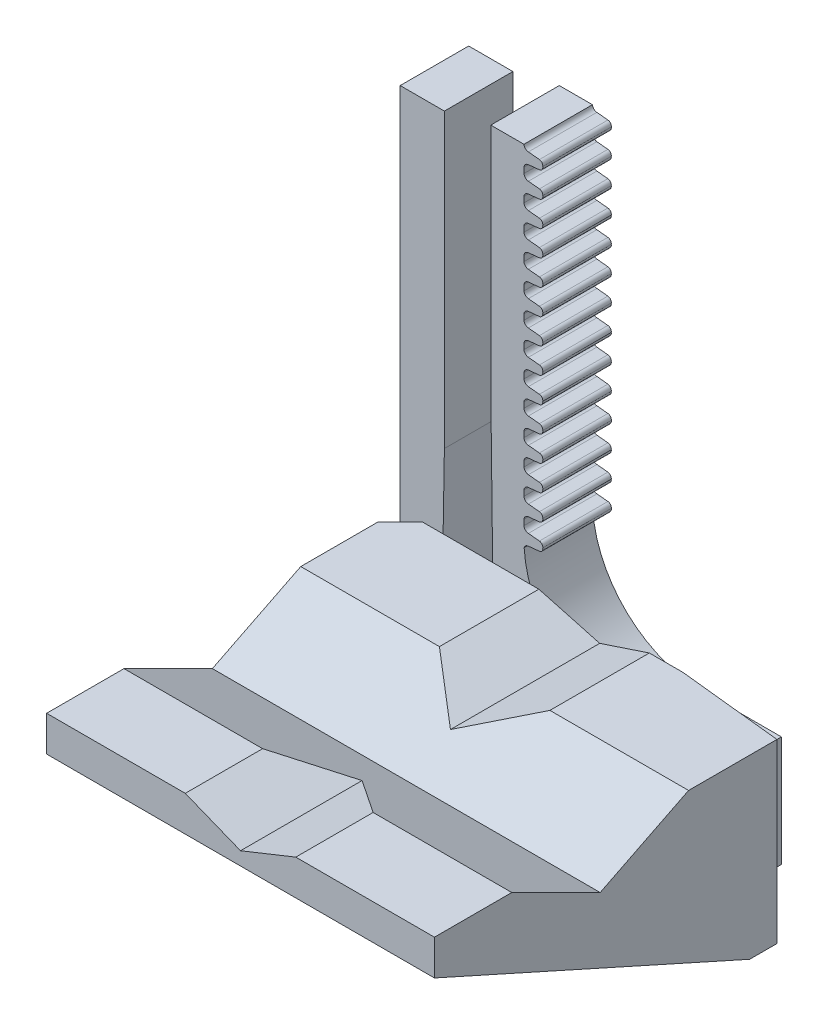
from build123d import *

# Parameters (mm, degrees)
BOSS_EXTRUDE1_DEPTH = 6.2
BOSS_EXTRUDE2_DEPTH = 21
CHAMFER1_SIZE       = 5
CHAMFER1_SIZE2      = 28.356409098
CUT_EXTRUDE1_REACH  = 74.109
CHAMFER2_SIZE       = 1
CHAMFER2_SIZE2      = 9.514364454
CHAMFER3_SIZE       = 2
CUT_EXTRUDE2_REACH  = 79.092
CUT_EXTRUDE3_START  = -3.468867
CUT_EXTRUDE3_DEPTH  = 3.468867
BOSS_EXTRUDE3_DEPTH = 6.2
CUT_EXTRUDE4_REACH  = 79.092
CUT_EXTRUDE5_DEPTH  = 73.108598655
CUT_EXTRUDE6_REACH  = 74.109


with BuildPart() as part:
    # Sketch1 → Boss-Extrude1 (new body)
    with BuildSketch(Plane.XY):
        with BuildLine():
            Line((-28.3, 0), (0, 0))
            Line((0, 0), (0, 10))
            Line((0, 10), (-7.1, 10))
            ThreePointArc((-7.1, 10), (-14.171067812, 12.928932188), (-17.1, 20))
            Line((-17.1, 20), (-17.1, 51))
            Line((-17.1, 51), (-20.1, 51))
            Line((-20.1, 51), (-20.1, 6))
            Line((-20.1, 6), (-24.3, 6))
            Line((-24.3, 6), (-24.3, 50))
            Line((-24.3, 50), (-28.3, 50))
            Line((-28.3, 50), (-28.3, 0))
        make_face()
    extrude(amount=BOSS_EXTRUDE1_DEPTH)

    # Sketch2 → Boss-Extrude2 (add)
    with BuildSketch(Plane.XZ):
        Polygon((0, 6.2), (0, 10.4), (11, 10.4), (11, 42.4), (-24.1, 42.4), (-24.1, 10.4), (-13.1, 10.4), (-13.1, 6.2), align=None)
    extrude(amount=-BOSS_EXTRUDE2_DEPTH)

    # Chamfer1
    chamfer1_edges = [part.edges().sort_by_distance(p)[0] for p in [
        (-6.55, 0, 42.4),
    ]]
    chamfer1_side = [part.faces().sort_by_distance(p)[0] for p in [
        (-6.55, 10.5, 42.4),
    ]]
    chamfer(chamfer1_edges, length=CHAMFER1_SIZE, length2=CHAMFER1_SIZE2, reference=chamfer1_side[0])

    # Sketch3 → Cut-Extrude1 (cut, up to next)
    with BuildSketch(Plane(origin=(0, 0, 0), x_dir=(0, 0, -1), z_dir=(1, 0, 0)), mode=Mode.PRIVATE) as cut_extrude1_sk1:
        Polygon((-6.2, 10), (-7.6, 10), (-10.4, 21), (-6.2, 21), align=None)
    cut_extrude1_tool1 = extrude(cut_extrude1_sk1.sketch, amount=-CUT_EXTRUDE1_REACH, mode=Mode.PRIVATE) & part.part
    add(cut_extrude1_tool1.solids().sort_by_distance((0, 16.416667, 7.716667))[0], mode=Mode.SUBTRACT)

    # Chamfer2
    chamfer2_edges = [part.edges().sort_by_distance(p)[0] for p in [
        (11, 10.5, 10.4),
    ]]
    chamfer2_side = [part.faces().sort_by_distance(p)[0] for p in [
        (11, 11.541747932, 25.62778603),
    ]]
    chamfer(chamfer2_edges, length=CHAMFER2_SIZE, length2=CHAMFER2_SIZE2, reference=chamfer2_side[0])

    # Chamfer3
    chamfer3_edges = [part.edges().sort_by_distance(p)[0] for p in [
        (-24.1, 10.5, 10.4),
    ]]
    chamfer(chamfer3_edges, length=CHAMFER3_SIZE)

    # Sketch5 → Cut-Extrude2 (cut, up to next)
    with BuildSketch(Plane(origin=(11, 0, 0), x_dir=(0, 0, -1), z_dir=(1, 0, 0)), mode=Mode.PRIVATE) as cut_extrude2_sk1:
        Polygon((-42.4, 17.8), (-13.86886709, 5), (-10.966215349, -4.108657177), (-44.036924755, 0.937700744), align=None)
    cut_extrude2_tool1 = extrude(cut_extrude2_sk1.sketch, amount=-CUT_EXTRUDE2_REACH, mode=Mode.PRIVATE) & part.part
    add(cut_extrude2_tool1.solids().sort_by_distance((11, 5.258773, 29.627692))[0], mode=Mode.SUBTRACT)

    # Sketch6 → Cut-Extrude3 (cut)
    with BuildSketch(Plane(origin=(0, 0, 10.4), x_dir=(-1, 0, 0), z_dir=(0, 0, -1)).offset(CUT_EXTRUDE3_START)):
        Polygon((13.1, 0), (24.1, 5), (37.198342989, 5), (28.62602328, -4.522208447), (-13.825974113, -5.629287686), (-20.705007466, 5), (-11, 5), (0, 0), align=None)
    extrude(amount=CUT_EXTRUDE3_DEPTH, mode=Mode.SUBTRACT)

    # Sketch7 → Boss-Extrude3 (add)
    with BuildSketch(Plane.XY.offset(6.2)):
        with BuildLine():
            Line((-16.7, 50.6), (-15.7, 50.5))
            ThreePointArc((-15.7, 50.5), (-15.462165524, 50.365875857), (-15.4, 50.1))
            ThreePointArc((-15.4, 50.1), (-15.462165524, 49.834124143), (-15.7, 49.7))
            Line((-15.7, 49.7), (-16.7, 49.6))
            ThreePointArc((-16.7, 49.6), (-16.971392676, 49.471392676), (-17.1, 49.2))
            Line((-17.1, 49.2), (-17.1, 48.7))
            ThreePointArc((-17.1, 48.7), (-16.971392676, 48.428607324), (-16.7, 48.3))
            Line((-16.7, 48.3), (-15.7, 48.2))
            ThreePointArc((-15.7, 48.2), (-15.462165524, 48.065875857), (-15.4, 47.8))
            ThreePointArc((-15.4, 47.8), (-15.462165524, 47.534124143), (-15.7, 47.4))
            Line((-15.7, 47.4), (-16.7, 47.3))
            ThreePointArc((-16.7, 47.3), (-16.971392676, 47.171392676), (-17.1, 46.9))
            Line((-17.1, 46.9), (-17.1, 46.4))
            ThreePointArc((-17.1, 46.4), (-16.971392676, 46.128607324), (-16.7, 46))
            Line((-16.7, 46), (-15.7, 45.9))
            ThreePointArc((-15.7, 45.9), (-15.462165524, 45.765875857), (-15.4, 45.5))
            ThreePointArc((-15.4, 45.5), (-15.462165524, 45.234124143), (-15.7, 45.1))
            Line((-15.7, 45.1), (-16.7, 45))
            ThreePointArc((-16.7, 45), (-16.971392676, 44.871392676), (-17.1, 44.6))
            Line((-17.1, 44.6), (-17.1, 44.1))
            ThreePointArc((-17.1, 44.1), (-16.971392676, 43.828607324), (-16.7, 43.7))
            Line((-16.7, 43.7), (-15.7, 43.6))
            ThreePointArc((-15.7, 43.6), (-15.462165524, 43.465875857), (-15.4, 43.2))
            ThreePointArc((-15.4, 43.2), (-15.462165524, 42.934124143), (-15.7, 42.8))
            Line((-15.7, 42.8), (-16.7, 42.7))
            ThreePointArc((-16.7, 42.7), (-16.971392676, 42.571392676), (-17.1, 42.3))
            Line((-17.1, 42.3), (-17.1, 41.8))
            ThreePointArc((-17.1, 41.8), (-16.971392676, 41.528607324), (-16.7, 41.4))
            Line((-16.7, 41.4), (-15.7, 41.3))
            ThreePointArc((-15.7, 41.3), (-15.462165524, 41.165875857), (-15.4, 40.9))
            ThreePointArc((-15.4, 40.9), (-15.462165524, 40.634124143), (-15.7, 40.5))
            Line((-15.7, 40.5), (-16.7, 40.4))
            ThreePointArc((-16.7, 40.4), (-16.971392676, 40.271392676), (-17.1, 40))
            Line((-17.1, 40), (-17.1, 39.5))
            ThreePointArc((-17.1, 39.5), (-16.971392676, 39.228607324), (-16.7, 39.1))
            Line((-16.7, 39.1), (-15.7, 39))
            ThreePointArc((-15.7, 39), (-15.462165524, 38.865875857), (-15.4, 38.6))
            ThreePointArc((-15.4, 38.6), (-15.462165524, 38.334124143), (-15.7, 38.2))
            Line((-15.7, 38.2), (-16.7, 38.1))
            ThreePointArc((-16.7, 38.1), (-16.971392676, 37.971392676), (-17.1, 37.7))
            Line((-17.1, 37.7), (-17.1, 37.2))
            ThreePointArc((-17.1, 37.2), (-16.971392676, 36.928607324), (-16.7, 36.8))
            Line((-16.7, 36.8), (-15.7, 36.7))
            ThreePointArc((-15.7, 36.7), (-15.462165524, 36.565875857), (-15.4, 36.3))
            ThreePointArc((-15.4, 36.3), (-15.462165524, 36.034124143), (-15.7, 35.9))
            Line((-15.7, 35.9), (-16.7, 35.8))
            ThreePointArc((-16.7, 35.8), (-16.971392676, 35.671392676), (-17.1, 35.4))
            Line((-17.1, 35.4), (-17.1, 34.9))
            ThreePointArc((-17.1, 34.9), (-16.971392676, 34.628607324), (-16.7, 34.5))
            Line((-16.7, 34.5), (-15.7, 34.4))
            ThreePointArc((-15.7, 34.4), (-15.462165524, 34.265875857), (-15.4, 34))
            ThreePointArc((-15.4, 34), (-15.462165524, 33.734124143), (-15.7, 33.6))
            Line((-15.7, 33.6), (-16.7, 33.5))
            ThreePointArc((-16.7, 33.5), (-16.971392676, 33.371392676), (-17.1, 33.1))
            Line((-17.1, 33.1), (-17.1, 32.6))
            ThreePointArc((-17.1, 32.6), (-16.971392676, 32.328607324), (-16.7, 32.2))
            Line((-16.7, 32.2), (-15.7, 32.1))
            ThreePointArc((-15.7, 32.1), (-15.462165524, 31.965875857), (-15.4, 31.7))
            ThreePointArc((-15.4, 31.7), (-15.462165524, 31.434124143), (-15.7, 31.3))
            Line((-15.7, 31.3), (-16.7, 31.2))
            ThreePointArc((-16.7, 31.2), (-16.971392676, 31.071392676), (-17.1, 30.8))
            Line((-17.1, 30.8), (-17.1, 30.3))
            ThreePointArc((-17.1, 30.3), (-16.971392676, 30.028607324), (-16.7, 29.9))
            Line((-16.7, 29.9), (-15.7, 29.8))
            ThreePointArc((-15.7, 29.8), (-15.462165524, 29.665875857), (-15.4, 29.4))
            ThreePointArc((-15.4, 29.4), (-15.462165524, 29.134124143), (-15.7, 29))
            Line((-15.7, 29), (-16.7, 28.9))
            ThreePointArc((-16.7, 28.9), (-16.971392676, 28.771392676), (-17.1, 28.5))
            Line((-17.1, 28.5), (-17.1, 28))
            ThreePointArc((-17.1, 28), (-16.971392676, 27.728607324), (-16.7, 27.6))
            Line((-16.7, 27.6), (-15.7, 27.5))
            ThreePointArc((-15.7, 27.5), (-15.462165524, 27.365875857), (-15.4, 27.1))
            ThreePointArc((-15.4, 27.1), (-15.462165524, 26.834124143), (-15.7, 26.7))
            Line((-15.7, 26.7), (-16.7, 26.6))
            ThreePointArc((-16.7, 26.6), (-16.971392676, 26.471392676), (-17.1, 26.2))
            Line((-17.1, 26.2), (-17.1, 25.7))
            ThreePointArc((-17.1, 25.7), (-16.971392676, 25.428607324), (-16.7, 25.3))
            Line((-16.7, 25.3), (-15.7, 25.2))
            ThreePointArc((-15.7, 25.2), (-15.462165524, 25.065875857), (-15.4, 24.8))
            ThreePointArc((-15.4, 24.8), (-15.462165524, 24.534124143), (-15.7, 24.4))
            Line((-15.7, 24.4), (-16.7, 24.3))
            ThreePointArc((-16.7, 24.3), (-16.971392676, 24.171392676), (-17.1, 23.9))
            Line((-17.1, 23.9), (-17.1, 23.4))
            ThreePointArc((-17.1, 23.4), (-16.971392676, 23.128607324), (-16.7, 23))
            Line((-16.7, 23), (-15.7, 22.9))
            ThreePointArc((-15.7, 22.9), (-15.462165524, 22.765875857), (-15.4, 22.5))
            ThreePointArc((-15.4, 22.5), (-15.462165524, 22.234124143), (-15.7, 22.1))
            Line((-15.7, 22.1), (-16.7, 22))
            ThreePointArc((-16.7, 22), (-16.971392676, 21.871392676), (-17.1, 21.6))
            Line((-17.1, 21.6), (-17.1, 21.1))
            ThreePointArc((-17.1, 21.1), (-16.971392676, 20.828607324), (-16.7, 20.7))
            Line((-16.7, 20.7), (-15.7, 20.6))
            ThreePointArc((-15.7, 20.6), (-15.462165524, 20.465875857), (-15.4, 20.2))
            ThreePointArc((-15.4, 20.2), (-15.462165524, 19.934124143), (-15.7, 19.8))
            Line((-15.7, 19.8), (-16.7, 19.7))
            ThreePointArc((-16.7, 19.7), (-16.971392676, 19.571392676), (-17.1, 19.3))
            Line((-17.1, 19.3), (-17.1, 18.8))
            Line((-17.1, 18.8), (-18.685, 49.2))
            Line((-18.685, 49.2), (-17.1, 51))
            ThreePointArc((-17.1, 51), (-16.971392676, 50.728607324), (-16.7, 50.6))
        make_face()
    extrude(amount=-BOSS_EXTRUDE3_DEPTH)

    # Sketch8 → Cut-Extrude4 (cut, up to next)
    with BuildSketch(Plane(origin=(11, 0, 0), x_dir=(0, 0, -1), z_dir=(1, 0, 0)), mode=Mode.PRIVATE) as cut_extrude4_sk1:
        Polygon((-35.4, 21), (-27.4, 17), (-19.4, 21), align=None)
    cut_extrude4_tool1 = extrude(cut_extrude4_sk1.sketch, amount=-CUT_EXTRUDE4_REACH, mode=Mode.PRIVATE) & part.part
    add(cut_extrude4_tool1.solids().sort_by_distance((11, 19.666667, 27.4))[0], mode=Mode.SUBTRACT)

    # Sketch10 → Cut-Extrude5 (cut, through all)
    with BuildSketch(Plane.XY.offset(42.4)):
        Polygon((-11.55, 21), (-6.55, 19), (-1.55, 21), align=None)
    extrude(amount=-CUT_EXTRUDE5_DEPTH, mode=Mode.SUBTRACT)

    # Sketch11 → Cut-Extrude6 (cut, up to next)
    with BuildSketch(Plane(origin=(0, 0, 0), x_dir=(-1, 0, 0), z_dir=(0, 0, -1)), mode=Mode.PRIVATE) as cut_extrude6_sk1:
        Polygon((24.3, 23.549969474), (24.6, 5.974018531), (19.8, 5.974018531), (20.1, 30.243837205), align=None)
    cut_extrude6_tool1 = extrude(cut_extrude6_sk1.sketch, amount=-CUT_EXTRUDE6_REACH, mode=Mode.PRIVATE) & part.part
    add(cut_extrude6_tool1.solids().sort_by_distance((-22.072028, 16.298165, 0))[0], mode=Mode.SUBTRACT)


solid = part.part
